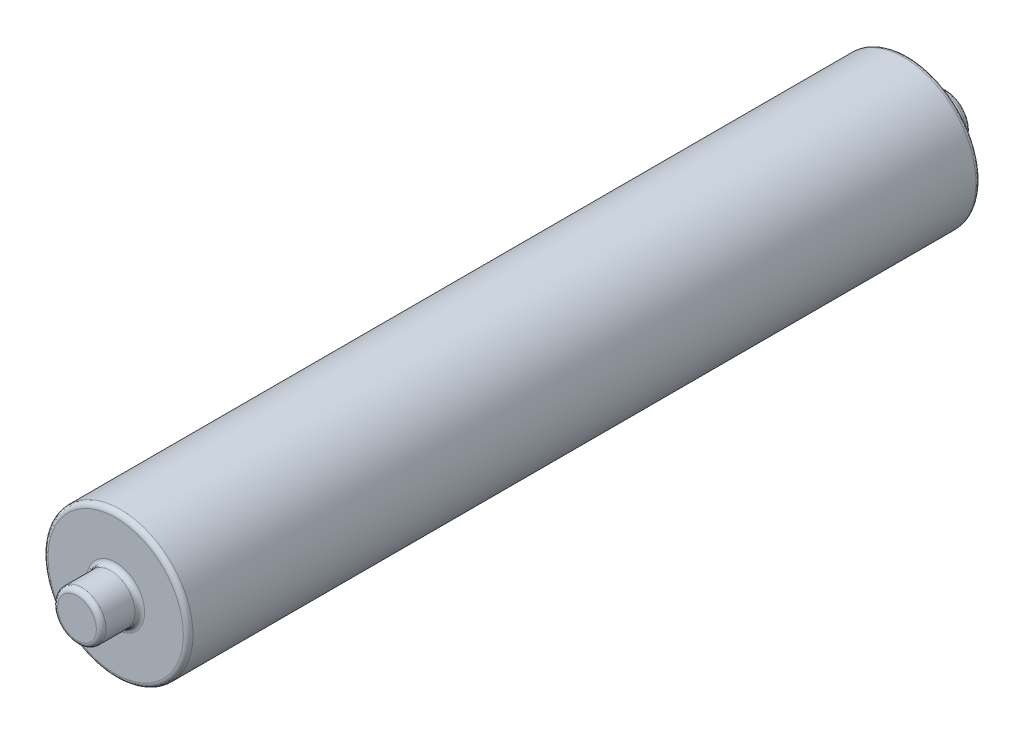
from build123d import *

# Parameters (mm, degrees)
CROQUIS1_R                   = 3.75
SALIENTE_EXTRUIR1_DEPTH      = 41
CROQUIS2_R                   = 1.25
SALIENTE_EXTRUIR2_DEPTH      = 2
SALIENTE_EXTRUIR3_DEPTH      = 0.0001
SALIENTE_EXTRUIR3_DEPTH_BACK = 45
CROQUIS3_R                   = 1.25
REDONDEO9_R                  = 0.25


with BuildPart() as part:
    # Croquis1 → Saliente-Extruir1 (new body)
    with BuildSketch(Plane.XY):
        Circle(CROQUIS1_R)
    extrude(amount=SALIENTE_EXTRUIR1_DEPTH)

    # Croquis2 → Saliente-Extruir2 (add)
    with BuildSketch(Plane(origin=(0, 0, 0), x_dir=(-1, 0, 0), z_dir=(0, 0, -1))):
        with Locations(Location((0, 0, 0), (0, 0, 180))):
            Circle(CROQUIS2_R)
    extrude(amount=SALIENTE_EXTRUIR2_DEPTH)

    # Croquis3 → Saliente-Extruir3 (add, two sides: drawn at the far end of the back side and taken through both)
    with BuildSketch(Plane(origin=(0, 0, -2), x_dir=(-1, 0, 0), z_dir=(0, 0, -1)).offset(-SALIENTE_EXTRUIR3_DEPTH_BACK)):
        with Locations(Location((0, 0, 0), (0, 0, 180))):
            Circle(CROQUIS3_R)
    extrude(amount=SALIENTE_EXTRUIR3_DEPTH + SALIENTE_EXTRUIR3_DEPTH_BACK)

    # Redondeo9
    redondeo9_edges = [part.edges().sort_by_distance(p)[0] for p in [
        (-1.25, 0, 43),
        (-1.25, 0, -2.0001),
        (-3.75, 0, 0),
        (-3.75, 0, 41),
        (-1.25, 0, 0),
        (-1.25, 0, 41),
    ]]
    fillet(redondeo9_edges, radius=REDONDEO9_R)


solid = part.part
